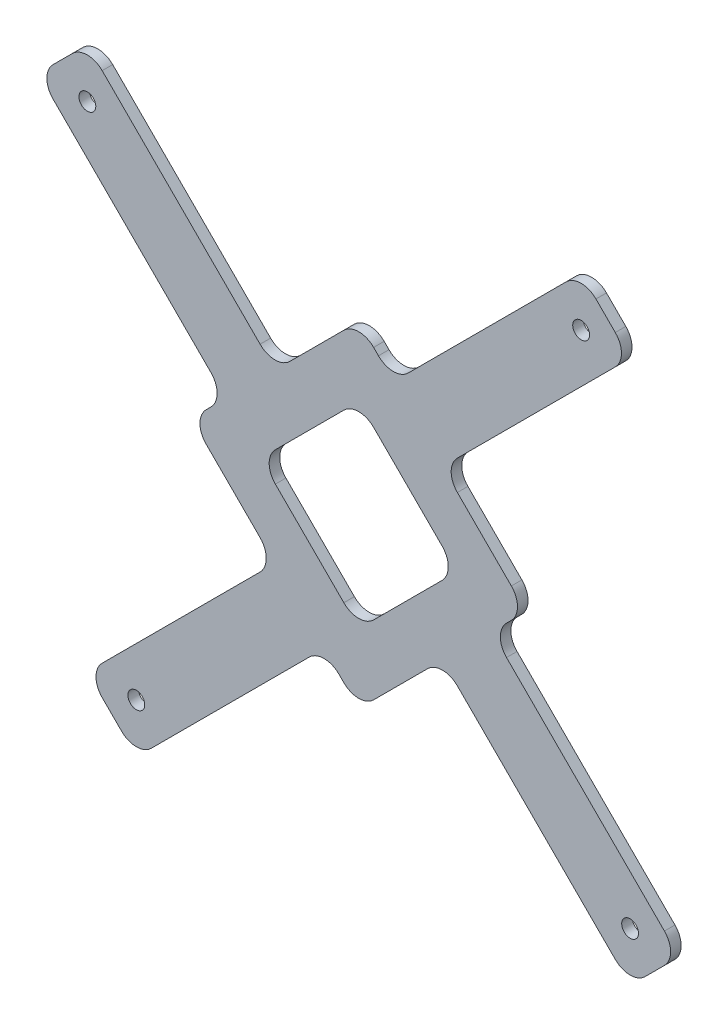
from build123d import *

# Parameters (mm, degrees)
SKETCH2_R           = 1.6
BOSS_EXTRUDE1_DEPTH = 2


with BuildPart() as part:
    # Sketch2 → Boss-Extrude1 (new body)
    with BuildSketch(Plane(origin=(0, 0, 70.507785861), x_dir=(-1, 0, 0), z_dir=(0, 0, -1))):
        with BuildLine():
            Line((-109.491735006, -65.754238005), (-99.238686679, -55.501189677))
            ThreePointArc((-99.238686679, -55.501189677), (-98.067113804, -52.672762553), (-99.238686679, -49.844335428))
            Line((-99.238686679, -49.844335428), (-129.24116868, -19.841853427))
            ThreePointArc((-129.24116868, -19.841853427), (-130.412741556, -17.013426302), (-129.24116868, -14.184999177))
            Line((-129.24116868, -14.184999177), (-125.564213418, -10.508043915))
            ThreePointArc((-125.564213418, -10.508043915), (-122.735786293, -9.33647104), (-119.907359169, -10.508043915))
            Line((-119.907359169, -10.508043915), (-89.904877167, -40.510525916))
            ThreePointArc((-89.904877167, -40.510525916), (-87.076450042, -41.682098792), (-84.248022918, -40.510525916))
            Line((-84.248022918, -40.510525916), (-83.328784102, -39.591287101))
            ThreePointArc((-83.328784102, -39.591287101), (-80.500356977, -38.419714226), (-77.671929853, -39.591287101))
            Line((-77.671929853, -39.591287101), (-67.418881525, -49.844335428))
            ThreePointArc((-67.418881525, -49.844335428), (-64.590454401, -51.015908303), (-61.762027276, -49.844335428))
            Line((-61.762027276, -49.844335428), (-31.759545275, -19.841853427))
            ThreePointArc((-31.759545275, -19.841853427), (-28.93111815, -18.670280551), (-26.102691025, -19.841853427))
            Line((-26.102691025, -19.841853427), (-22.425735763, -23.518808689))
            ThreePointArc((-22.425735763, -23.518808689), (-21.254162888, -26.347235813), (-22.425735763, -29.175662938))
            Line((-22.425735763, -29.175662938), (-52.428217764, -59.17814494))
            ThreePointArc((-52.428217764, -59.17814494), (-53.59979064, -62.006572064), (-52.428217764, -64.834999189))
            Line((-52.428217764, -64.834999189), (-51.508978949, -65.754238005))
            ThreePointArc((-51.508978949, -65.754238005), (-50.337406074, -68.582665129), (-51.508978949, -71.411092254))
            Line((-51.508978949, -71.411092254), (-61.762027276, -81.664140581))
            ThreePointArc((-61.762027276, -81.664140581), (-62.933600151, -84.492567706), (-61.762027276, -87.320994831))
            Line((-61.762027276, -87.320994831), (-31.759545275, -117.323476832))
            ThreePointArc((-31.759545275, -117.323476832), (-30.587972399, -120.151903957), (-31.759545275, -122.980331082))
            Line((-31.759545275, -122.980331082), (-35.436500537, -126.657286344))
            ThreePointArc((-35.436500537, -126.657286344), (-38.264927661, -127.828859219), (-41.093354786, -126.657286344))
            Line((-41.093354786, -126.657286344), (-71.095836788, -96.654804343))
            ThreePointArc((-71.095836788, -96.654804343), (-73.924263912, -95.483231467), (-76.752691037, -96.654804343))
            Line((-76.752691037, -96.654804343), (-77.671929853, -97.574043158))
            ThreePointArc((-77.671929853, -97.574043158), (-80.500356977, -98.745616033), (-83.328784102, -97.574043158))
            Line((-83.328784102, -97.574043158), (-93.581832429, -87.320994831))
            ThreePointArc((-93.581832429, -87.320994831), (-96.410259554, -86.149421956), (-99.238686679, -87.320994831))
            Line((-99.238686679, -87.320994831), (-129.24116868, -117.323476832))
            ThreePointArc((-129.24116868, -117.323476832), (-132.069595805, -118.495049708), (-134.89802293, -117.323476832))
            Line((-134.89802293, -117.323476832), (-138.574978192, -113.64652157))
            ThreePointArc((-138.574978192, -113.64652157), (-139.746551067, -110.818094445), (-138.574978192, -107.989667321))
            Line((-138.574978192, -107.989667321), (-108.572496191, -77.987185319))
            ThreePointArc((-108.572496191, -77.987185319), (-107.400923315, -75.158758194), (-108.572496191, -72.33033107))
            Line((-108.572496191, -72.33033107), (-109.491735006, -71.411092254))
            ThreePointArc((-109.491735006, -71.411092254), (-110.663307881, -68.582665129), (-109.491735006, -65.754238005))
        make_face()
        with Locations((-132.055025121, -110.832665129)):
            Circle(SKETCH2_R, mode=Mode.SUBTRACT)
        with Locations((-28.945688834, -26.332665129)):
            Circle(SKETCH2_R, mode=Mode.SUBTRACT)
        with Locations((-122.750356977, -17.027996986)):
            Circle(SKETCH2_R, mode=Mode.SUBTRACT)
        with Locations((-38.250356977, -120.137333273)):
            Circle(SKETCH2_R, mode=Mode.SUBTRACT)
        with BuildLine():
            Line((-96.339548876, -65.754238005), (-83.328784102, -52.743473231))
            ThreePointArc((-83.328784102, -52.743473231), (-80.500356977, -51.571900356), (-77.671929853, -52.743473231))
            Line((-77.671929853, -52.743473231), (-64.661165079, -65.754238005))
            ThreePointArc((-64.661165079, -65.754238005), (-63.489592204, -68.582665129), (-64.661165079, -71.411092254))
            Line((-64.661165079, -71.411092254), (-77.671929853, -84.421857028))
            ThreePointArc((-77.671929853, -84.421857028), (-80.500356977, -85.593429903), (-83.328784102, -84.421857028))
            Line((-83.328784102, -84.421857028), (-96.339548876, -71.411092254))
            ThreePointArc((-96.339548876, -71.411092254), (-97.511121751, -68.582665129), (-96.339548876, -65.754238005))
        make_face(mode=Mode.SUBTRACT)
    extrude(amount=BOSS_EXTRUDE1_DEPTH)


solid = part.part
